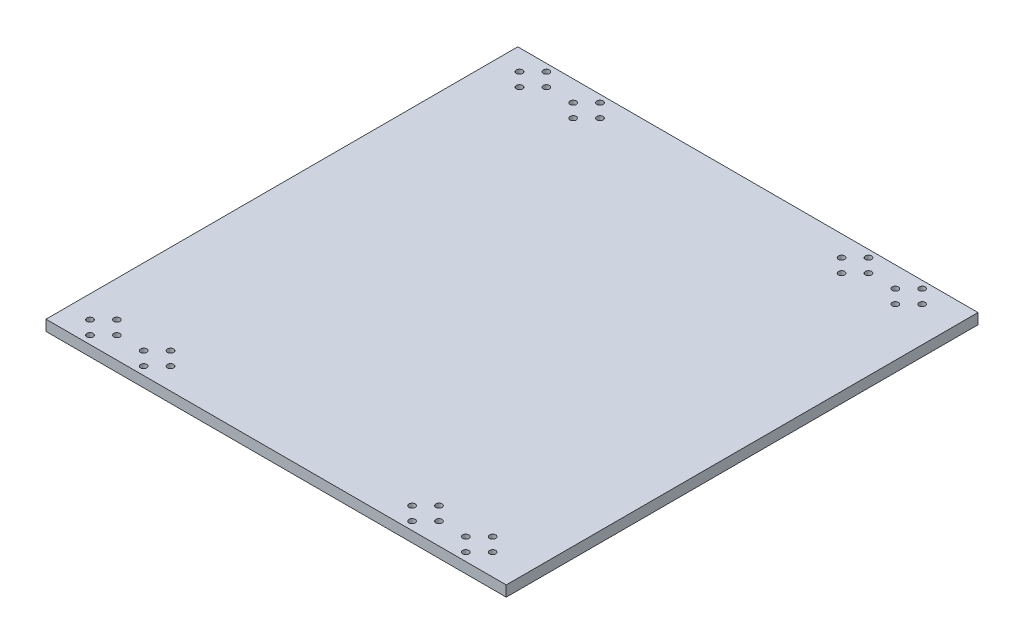
from build123d import *

# Parameters (mm, degrees)
SKETCH1_W           = 274.32
SKETCH1_H           = 288.036
BOSS_EXTRUDE1_DEPTH = 6.35
CUT_EXTRUDE1_REACH  = 243.958
SKETCH2_R           = 1.85
CUT_EXTRUDE2_REACH  = 243.958
SKETCH2_5_R         = 1.85
CUT_EXTRUDE3_REACH  = 243.958
SKETCH3_W           = 274.32
SKETCH3_H           = 3.146129422
SKETCH3_H_2         = 3.695646794


with BuildPart() as part:
    # Sketch1 → Boss-Extrude1 (new body)
    with BuildSketch(Plane(origin=(0, 0, 0), x_dir=(1, 0, 0), z_dir=(0, 1, 0))):
        with Locations((5.067487685, -51.620807882)):
            Rectangle(SKETCH1_W, SKETCH1_H)
    extrude(amount=BOSS_EXTRUDE1_DEPTH)

    # Sketch2 → Cut-Extrude1 (cut, up to next)
    with BuildSketch(Plane.XZ, mode=Mode.PRIVATE) as cut_extrude1_sk1:
        with Locations((-86.722512315, -76.361192118)):
            Circle(SKETCH2_R)
    cut_extrude1_tool1 = extrude(cut_extrude1_sk1.sketch, amount=-CUT_EXTRUDE1_REACH, mode=Mode.PRIVATE) & part.part
    # Sketch2 → Cut-Extrude1 (cut, up to next)
    with BuildSketch(Plane.XZ, mode=Mode.PRIVATE) as cut_extrude1_sk2:
        with Locations((-118.722512315, -76.361192118)):
            Circle(SKETCH2_R)
    cut_extrude1_tool2 = extrude(cut_extrude1_sk2.sketch, amount=-CUT_EXTRUDE1_REACH, mode=Mode.PRIVATE) & part.part
    # Sketch2 → Cut-Extrude1 (cut, up to next)
    with BuildSketch(Plane.XZ, mode=Mode.PRIVATE) as cut_extrude1_sk3:
        with Locations((-110.722512315, -84.361192118)):
            Circle(SKETCH2_R)
    cut_extrude1_tool3 = extrude(cut_extrude1_sk3.sketch, amount=-CUT_EXTRUDE1_REACH, mode=Mode.PRIVATE) & part.part
    # Sketch2 → Cut-Extrude1 (cut, up to next)
    with BuildSketch(Plane.XZ, mode=Mode.PRIVATE) as cut_extrude1_sk4:
        with Locations((-102.722512315, -76.361192118)):
            Circle(SKETCH2_R)
    cut_extrude1_tool4 = extrude(cut_extrude1_sk4.sketch, amount=-CUT_EXTRUDE1_REACH, mode=Mode.PRIVATE) & part.part
    # Sketch2 → Cut-Extrude1 (cut, up to next)
    with BuildSketch(Plane.XZ, mode=Mode.PRIVATE) as cut_extrude1_sk5:
        with Locations((-110.722512315, -68.361192118)):
            Circle(SKETCH2_R)
    cut_extrude1_tool5 = extrude(cut_extrude1_sk5.sketch, amount=-CUT_EXTRUDE1_REACH, mode=Mode.PRIVATE) & part.part
    # Sketch2 → Cut-Extrude1 (cut, up to next)
    with BuildSketch(Plane.XZ, mode=Mode.PRIVATE) as cut_extrude1_sk6:
        with Locations((-70.722512315, -76.361192118)):
            Circle(SKETCH2_R)
    cut_extrude1_tool6 = extrude(cut_extrude1_sk6.sketch, amount=-CUT_EXTRUDE1_REACH, mode=Mode.PRIVATE) & part.part
    # Sketch2 → Cut-Extrude1 (cut, up to next)
    with BuildSketch(Plane.XZ, mode=Mode.PRIVATE) as cut_extrude1_sk7:
        with Locations((-78.722512315, -68.361192118)):
            Circle(SKETCH2_R)
    cut_extrude1_tool7 = extrude(cut_extrude1_sk7.sketch, amount=-CUT_EXTRUDE1_REACH, mode=Mode.PRIVATE) & part.part
    # Sketch2 → Cut-Extrude1 (cut, up to next)
    with BuildSketch(Plane.XZ, mode=Mode.PRIVATE) as cut_extrude1_sk8:
        with Locations((-78.722512315, -84.361192118)):
            Circle(SKETCH2_R)
    cut_extrude1_tool8 = extrude(cut_extrude1_sk8.sketch, amount=-CUT_EXTRUDE1_REACH, mode=Mode.PRIVATE) & part.part
    add(cut_extrude1_tool1.solids().sort_by_distance((-86.722512, 0, -76.361192))[0], mode=Mode.SUBTRACT)
    add(cut_extrude1_tool2.solids().sort_by_distance((-118.722512, 0, -76.361192))[0], mode=Mode.SUBTRACT)
    add(cut_extrude1_tool3.solids().sort_by_distance((-110.722512, 0, -84.361192))[0], mode=Mode.SUBTRACT)
    add(cut_extrude1_tool4.solids().sort_by_distance((-102.722512, 0, -76.361192))[0], mode=Mode.SUBTRACT)
    add(cut_extrude1_tool5.solids().sort_by_distance((-110.722512, 0, -68.361192))[0], mode=Mode.SUBTRACT)
    add(cut_extrude1_tool6.solids().sort_by_distance((-70.722512, 0, -76.361192))[0], mode=Mode.SUBTRACT)
    add(cut_extrude1_tool7.solids().sort_by_distance((-78.722512, 0, -68.361192))[0], mode=Mode.SUBTRACT)
    add(cut_extrude1_tool8.solids().sort_by_distance((-78.722512, 0, -84.361192))[0], mode=Mode.SUBTRACT)

    # Sketch2<5> → Cut-Extrude2 (cut, up to next)
    with BuildSketch(Plane.XZ, mode=Mode.PRIVATE) as cut_extrude2_sk1:
        with Locations((121.277487685, -76.361192118)):
            Circle(SKETCH2_5_R)
    cut_extrude2_tool1 = extrude(cut_extrude2_sk1.sketch, amount=-CUT_EXTRUDE2_REACH, mode=Mode.PRIVATE) & part.part
    # Sketch2<5> → Cut-Extrude2 (cut, up to next)
    with BuildSketch(Plane.XZ, mode=Mode.PRIVATE) as cut_extrude2_sk2:
        with Locations((105.277487685, -76.361192118)):
            Circle(SKETCH2_5_R)
    cut_extrude2_tool2 = extrude(cut_extrude2_sk2.sketch, amount=-CUT_EXTRUDE2_REACH, mode=Mode.PRIVATE) & part.part
    # Sketch2<5> → Cut-Extrude2 (cut, up to next)
    with BuildSketch(Plane.XZ, mode=Mode.PRIVATE) as cut_extrude2_sk3:
        with Locations((113.277487685, -84.361192118)):
            Circle(SKETCH2_5_R)
    cut_extrude2_tool3 = extrude(cut_extrude2_sk3.sketch, amount=-CUT_EXTRUDE2_REACH, mode=Mode.PRIVATE) & part.part
    # Sketch2<5> → Cut-Extrude2 (cut, up to next)
    with BuildSketch(Plane.XZ, mode=Mode.PRIVATE) as cut_extrude2_sk4:
        with Locations((113.277487685, -68.361192118)):
            Circle(SKETCH2_5_R)
    cut_extrude2_tool4 = extrude(cut_extrude2_sk4.sketch, amount=-CUT_EXTRUDE2_REACH, mode=Mode.PRIVATE) & part.part
    # Sketch2<5> → Cut-Extrude2 (cut, up to next)
    with BuildSketch(Plane.XZ, mode=Mode.PRIVATE) as cut_extrude2_sk5:
        with Locations((89.277487685, -76.361192118)):
            Circle(SKETCH2_5_R)
    cut_extrude2_tool5 = extrude(cut_extrude2_sk5.sketch, amount=-CUT_EXTRUDE2_REACH, mode=Mode.PRIVATE) & part.part
    # Sketch2<5> → Cut-Extrude2 (cut, up to next)
    with BuildSketch(Plane.XZ, mode=Mode.PRIVATE) as cut_extrude2_sk6:
        with Locations((81.277487685, -84.361192118)):
            Circle(SKETCH2_5_R)
    cut_extrude2_tool6 = extrude(cut_extrude2_sk6.sketch, amount=-CUT_EXTRUDE2_REACH, mode=Mode.PRIVATE) & part.part
    # Sketch2<5> → Cut-Extrude2 (cut, up to next)
    with BuildSketch(Plane.XZ, mode=Mode.PRIVATE) as cut_extrude2_sk7:
        with Locations((81.277487685, -68.361192118)):
            Circle(SKETCH2_5_R)
    cut_extrude2_tool7 = extrude(cut_extrude2_sk7.sketch, amount=-CUT_EXTRUDE2_REACH, mode=Mode.PRIVATE) & part.part
    # Sketch2<5> → Cut-Extrude2 (cut, up to next)
    with BuildSketch(Plane.XZ, mode=Mode.PRIVATE) as cut_extrude2_sk8:
        with Locations((73.277487685, -76.361192118)):
            Circle(SKETCH2_5_R)
    cut_extrude2_tool8 = extrude(cut_extrude2_sk8.sketch, amount=-CUT_EXTRUDE2_REACH, mode=Mode.PRIVATE) & part.part
    # Sketch2<5> → Cut-Extrude2 (cut, up to next)
    with BuildSketch(Plane.XZ, mode=Mode.PRIVATE) as cut_extrude2_sk9:
        with Locations((73.277487685, 179.638807882)):
            Circle(SKETCH2_5_R)
    cut_extrude2_tool9 = extrude(cut_extrude2_sk9.sketch, amount=-CUT_EXTRUDE2_REACH, mode=Mode.PRIVATE) & part.part
    # Sketch2<5> → Cut-Extrude2 (cut, up to next)
    with BuildSketch(Plane.XZ, mode=Mode.PRIVATE) as cut_extrude2_sk10:
        with Locations((81.277487685, 187.638807882)):
            Circle(SKETCH2_5_R)
    cut_extrude2_tool10 = extrude(cut_extrude2_sk10.sketch, amount=-CUT_EXTRUDE2_REACH, mode=Mode.PRIVATE) & part.part
    # Sketch2<5> → Cut-Extrude2 (cut, up to next)
    with BuildSketch(Plane.XZ, mode=Mode.PRIVATE) as cut_extrude2_sk11:
        with Locations((81.277487685, 171.638807882)):
            Circle(SKETCH2_5_R)
    cut_extrude2_tool11 = extrude(cut_extrude2_sk11.sketch, amount=-CUT_EXTRUDE2_REACH, mode=Mode.PRIVATE) & part.part
    # Sketch2<5> → Cut-Extrude2 (cut, up to next)
    with BuildSketch(Plane.XZ, mode=Mode.PRIVATE) as cut_extrude2_sk12:
        with Locations((89.277487685, 179.638807882)):
            Circle(SKETCH2_5_R)
    cut_extrude2_tool12 = extrude(cut_extrude2_sk12.sketch, amount=-CUT_EXTRUDE2_REACH, mode=Mode.PRIVATE) & part.part
    # Sketch2<5> → Cut-Extrude2 (cut, up to next)
    with BuildSketch(Plane.XZ, mode=Mode.PRIVATE) as cut_extrude2_sk13:
        with Locations((105.277487685, 179.638807882)):
            Circle(SKETCH2_5_R)
    cut_extrude2_tool13 = extrude(cut_extrude2_sk13.sketch, amount=-CUT_EXTRUDE2_REACH, mode=Mode.PRIVATE) & part.part
    # Sketch2<5> → Cut-Extrude2 (cut, up to next)
    with BuildSketch(Plane.XZ, mode=Mode.PRIVATE) as cut_extrude2_sk14:
        with Locations((113.277487685, 187.638807882)):
            Circle(SKETCH2_5_R)
    cut_extrude2_tool14 = extrude(cut_extrude2_sk14.sketch, amount=-CUT_EXTRUDE2_REACH, mode=Mode.PRIVATE) & part.part
    # Sketch2<5> → Cut-Extrude2 (cut, up to next)
    with BuildSketch(Plane.XZ, mode=Mode.PRIVATE) as cut_extrude2_sk15:
        with Locations((121.277487685, 179.638807882)):
            Circle(SKETCH2_5_R)
    cut_extrude2_tool15 = extrude(cut_extrude2_sk15.sketch, amount=-CUT_EXTRUDE2_REACH, mode=Mode.PRIVATE) & part.part
    # Sketch2<5> → Cut-Extrude2 (cut, up to next)
    with BuildSketch(Plane.XZ, mode=Mode.PRIVATE) as cut_extrude2_sk16:
        with Locations((113.277487685, 171.638807882)):
            Circle(SKETCH2_5_R)
    cut_extrude2_tool16 = extrude(cut_extrude2_sk16.sketch, amount=-CUT_EXTRUDE2_REACH, mode=Mode.PRIVATE) & part.part
    # Sketch2<5> → Cut-Extrude2 (cut, up to next)
    with BuildSketch(Plane.XZ, mode=Mode.PRIVATE) as cut_extrude2_sk17:
        with Locations((-70.722512315, 179.638807882)):
            Circle(SKETCH2_5_R)
    cut_extrude2_tool17 = extrude(cut_extrude2_sk17.sketch, amount=-CUT_EXTRUDE2_REACH, mode=Mode.PRIVATE) & part.part
    # Sketch2<5> → Cut-Extrude2 (cut, up to next)
    with BuildSketch(Plane.XZ, mode=Mode.PRIVATE) as cut_extrude2_sk18:
        with Locations((-78.722512315, 187.638807882)):
            Circle(SKETCH2_5_R)
    cut_extrude2_tool18 = extrude(cut_extrude2_sk18.sketch, amount=-CUT_EXTRUDE2_REACH, mode=Mode.PRIVATE) & part.part
    # Sketch2<5> → Cut-Extrude2 (cut, up to next)
    with BuildSketch(Plane.XZ, mode=Mode.PRIVATE) as cut_extrude2_sk19:
        with Locations((-78.722512315, 171.638807882)):
            Circle(SKETCH2_5_R)
    cut_extrude2_tool19 = extrude(cut_extrude2_sk19.sketch, amount=-CUT_EXTRUDE2_REACH, mode=Mode.PRIVATE) & part.part
    # Sketch2<5> → Cut-Extrude2 (cut, up to next)
    with BuildSketch(Plane.XZ, mode=Mode.PRIVATE) as cut_extrude2_sk20:
        with Locations((-86.722512315, 179.638807882)):
            Circle(SKETCH2_5_R)
    cut_extrude2_tool20 = extrude(cut_extrude2_sk20.sketch, amount=-CUT_EXTRUDE2_REACH, mode=Mode.PRIVATE) & part.part
    # Sketch2<5> → Cut-Extrude2 (cut, up to next)
    with BuildSketch(Plane.XZ, mode=Mode.PRIVATE) as cut_extrude2_sk21:
        with Locations((-102.722512315, 179.638807882)):
            Circle(SKETCH2_5_R)
    cut_extrude2_tool21 = extrude(cut_extrude2_sk21.sketch, amount=-CUT_EXTRUDE2_REACH, mode=Mode.PRIVATE) & part.part
    # Sketch2<5> → Cut-Extrude2 (cut, up to next)
    with BuildSketch(Plane.XZ, mode=Mode.PRIVATE) as cut_extrude2_sk22:
        with Locations((-110.722512315, 187.638807882)):
            Circle(SKETCH2_5_R)
    cut_extrude2_tool22 = extrude(cut_extrude2_sk22.sketch, amount=-CUT_EXTRUDE2_REACH, mode=Mode.PRIVATE) & part.part
    # Sketch2<5> → Cut-Extrude2 (cut, up to next)
    with BuildSketch(Plane.XZ, mode=Mode.PRIVATE) as cut_extrude2_sk23:
        with Locations((-118.722512315, 179.638807882)):
            Circle(SKETCH2_5_R)
    cut_extrude2_tool23 = extrude(cut_extrude2_sk23.sketch, amount=-CUT_EXTRUDE2_REACH, mode=Mode.PRIVATE) & part.part
    # Sketch2<5> → Cut-Extrude2 (cut, up to next)
    with BuildSketch(Plane.XZ, mode=Mode.PRIVATE) as cut_extrude2_sk24:
        with Locations((-110.722512315, 171.638807882)):
            Circle(SKETCH2_5_R)
    cut_extrude2_tool24 = extrude(cut_extrude2_sk24.sketch, amount=-CUT_EXTRUDE2_REACH, mode=Mode.PRIVATE) & part.part
    add(cut_extrude2_tool1.solids().sort_by_distance((121.277488, 0, -76.361192))[0], mode=Mode.SUBTRACT)
    add(cut_extrude2_tool2.solids().sort_by_distance((105.277488, 0, -76.361192))[0], mode=Mode.SUBTRACT)
    add(cut_extrude2_tool3.solids().sort_by_distance((113.277488, 0, -84.361192))[0], mode=Mode.SUBTRACT)
    add(cut_extrude2_tool4.solids().sort_by_distance((113.277488, 0, -68.361192))[0], mode=Mode.SUBTRACT)
    add(cut_extrude2_tool5.solids().sort_by_distance((89.277488, 0, -76.361192))[0], mode=Mode.SUBTRACT)
    add(cut_extrude2_tool6.solids().sort_by_distance((81.277488, 0, -84.361192))[0], mode=Mode.SUBTRACT)
    add(cut_extrude2_tool7.solids().sort_by_distance((81.277488, 0, -68.361192))[0], mode=Mode.SUBTRACT)
    add(cut_extrude2_tool8.solids().sort_by_distance((73.277488, 0, -76.361192))[0], mode=Mode.SUBTRACT)
    add(cut_extrude2_tool9.solids().sort_by_distance((73.277488, 0, 179.638808))[0], mode=Mode.SUBTRACT)
    add(cut_extrude2_tool10.solids().sort_by_distance((81.277488, 0, 187.638808))[0], mode=Mode.SUBTRACT)
    add(cut_extrude2_tool11.solids().sort_by_distance((81.277488, 0, 171.638808))[0], mode=Mode.SUBTRACT)
    add(cut_extrude2_tool12.solids().sort_by_distance((89.277488, 0, 179.638808))[0], mode=Mode.SUBTRACT)
    add(cut_extrude2_tool13.solids().sort_by_distance((105.277488, 0, 179.638808))[0], mode=Mode.SUBTRACT)
    add(cut_extrude2_tool14.solids().sort_by_distance((113.277488, 0, 187.638808))[0], mode=Mode.SUBTRACT)
    add(cut_extrude2_tool15.solids().sort_by_distance((121.277488, 0, 179.638808))[0], mode=Mode.SUBTRACT)
    add(cut_extrude2_tool16.solids().sort_by_distance((113.277488, 0, 171.638808))[0], mode=Mode.SUBTRACT)
    add(cut_extrude2_tool17.solids().sort_by_distance((-70.722512, 0, 179.638808))[0], mode=Mode.SUBTRACT)
    add(cut_extrude2_tool18.solids().sort_by_distance((-78.722512, 0, 187.638808))[0], mode=Mode.SUBTRACT)
    add(cut_extrude2_tool19.solids().sort_by_distance((-78.722512, 0, 171.638808))[0], mode=Mode.SUBTRACT)
    add(cut_extrude2_tool20.solids().sort_by_distance((-86.722512, 0, 179.638808))[0], mode=Mode.SUBTRACT)
    add(cut_extrude2_tool21.solids().sort_by_distance((-102.722512, 0, 179.638808))[0], mode=Mode.SUBTRACT)
    add(cut_extrude2_tool22.solids().sort_by_distance((-110.722512, 0, 187.638808))[0], mode=Mode.SUBTRACT)
    add(cut_extrude2_tool23.solids().sort_by_distance((-118.722512, 0, 179.638808))[0], mode=Mode.SUBTRACT)
    add(cut_extrude2_tool24.solids().sort_by_distance((-110.722512, 0, 171.638808))[0], mode=Mode.SUBTRACT)

    # Sketch3 → Cut-Extrude3 (cut, up to next)
    with BuildSketch(Plane.XZ, mode=Mode.PRIVATE) as cut_extrude3_sk1:
        with Locations((5.067487685, 194.065743171)):
            Rectangle(SKETCH3_W, SKETCH3_H)
    cut_extrude3_tool1 = extrude(cut_extrude3_sk1.sketch, amount=-CUT_EXTRUDE3_REACH, mode=Mode.PRIVATE) & part.part
    # Sketch3 → Cut-Extrude3 (cut, up to next)
    with BuildSketch(Plane.XZ, mode=Mode.PRIVATE) as cut_extrude3_sk2:
        with Locations((5.067487685, -90.549368721)):
            Rectangle(SKETCH3_W, SKETCH3_H_2)
    cut_extrude3_tool2 = extrude(cut_extrude3_sk2.sketch, amount=-CUT_EXTRUDE3_REACH, mode=Mode.PRIVATE) & part.part
    add(cut_extrude3_tool1.solids().sort_by_distance((5.067488, 0, 194.065743))[0], mode=Mode.SUBTRACT)
    add(cut_extrude3_tool2.solids().sort_by_distance((5.067488, 0, -90.549369))[0], mode=Mode.SUBTRACT)


solid = part.part
